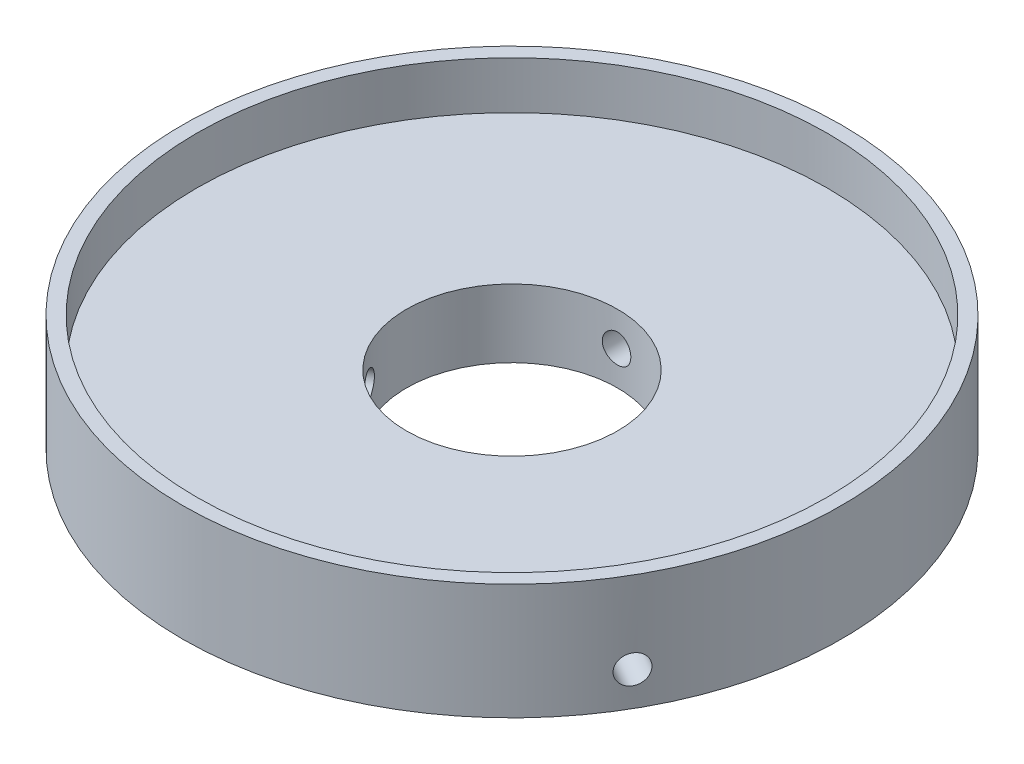
from build123d import *

# Parameters (mm, degrees)
SKETCH2_R               = 33.1665
SKETCH2_R_2             = 11.1
BOSS_EXTRUDE1_DEPTH     = 7.175
SKETCH2_5_R             = 34.6665
SKETCH2_5_R_2           = 33.1665
BOSS_EXTRUDE2_DEPTH     = 12.175
CIRPATTERN1_COUNT       = 3
CUT_EXTRUDE3_REACH      = 85.886
CUT_EXTRUDE3_END_RADIUS = 11.1
SKETCH5_R               = 1.5
CIRPATTERN2_COUNT       = 3


with BuildPart() as part:
    # Sketch2 → Boss-Extrude1 (new body)
    with BuildSketch(Plane(origin=(0, 0, 0), x_dir=(1, 0, 0), z_dir=(0, 1, 0))):
        Circle(SKETCH2_R)
        Circle(SKETCH2_R_2, mode=Mode.SUBTRACT)
    extrude(amount=BOSS_EXTRUDE1_DEPTH)

    # Sketch2<5> → Boss-Extrude2 (add)
    with BuildSketch(Plane(origin=(0, 0, 0), x_dir=(1, 0, 0), z_dir=(0, 1, 0))):
        Circle(SKETCH2_5_R)
        Circle(SKETCH2_5_R_2, mode=Mode.SUBTRACT)
    extrude(amount=BOSS_EXTRUDE2_DEPTH)

    # Sketch3 → Cut-Revolve1 (revolve, cut)
    with BuildSketch(Plane.XZ):
        with BuildLine():
            Line((2.5019, 18), (-2.5019, 18))
            ThreePointArc((-2.5019, 18), (0, 15.4981), (2.5019, 18))
        make_face()
    cut_revolve1 = revolve(axis=Axis((3.292813159, 0, 18), (-1, 0, 0)), mode=Mode.SUBTRACT)

    # CirPattern1: Cut-Revolve1 ×3 about axis
    cirpattern1_axis = Axis((0, 0, 0), (0, 1, 0))
    for i in range(1, CIRPATTERN1_COUNT):
        add(cut_revolve1.rotate(cirpattern1_axis, i * 360 / CIRPATTERN1_COUNT), mode=Mode.SUBTRACT)

    # Cut-Extrude3: up to this cylinder (the profile starts outside it)
    cut_extrude3_end = Plane(origin=(0, 3.5875, 0), z_dir=(0, -1, 0)) * Cylinder(CUT_EXTRUDE3_END_RADIUS, 194.972, mode=Mode.PRIVATE)
    # Sketch5 → Cut-Extrude3 (cut, up to the surface)
    with BuildSketch(Plane(origin=(30.02206966, 0, 17.33325), x_dir=(0.4999999999999922, 0, -0.8660254037844431), z_dir=(0.8660254037844431, 0, 0.4999999999999922)), mode=Mode.PRIVATE) as cut_extrude3_sk1:
        with Locations((0, 3.5875)):
            Circle(SKETCH5_R)
    cut_extrude3_tool1 = extrude(cut_extrude3_sk1.sketch, amount=-CUT_EXTRUDE3_REACH, mode=Mode.PRIVATE) - cut_extrude3_end
    cut_extrude3 = cut_extrude3_tool1.solids().sort_by_distance((30.02207, 3.5875, 17.33325))[0]
    add(cut_extrude3, mode=Mode.SUBTRACT)

    # CirPattern2: Cut-Extrude3 ×3 about axis
    cirpattern2_axis = Axis((0, 12.175, 0), (0, -1, 0))
    for i in range(1, CIRPATTERN2_COUNT):
        add(cut_extrude3.rotate(cirpattern2_axis, i * 360 / CIRPATTERN2_COUNT), mode=Mode.SUBTRACT)


solid = part.part
